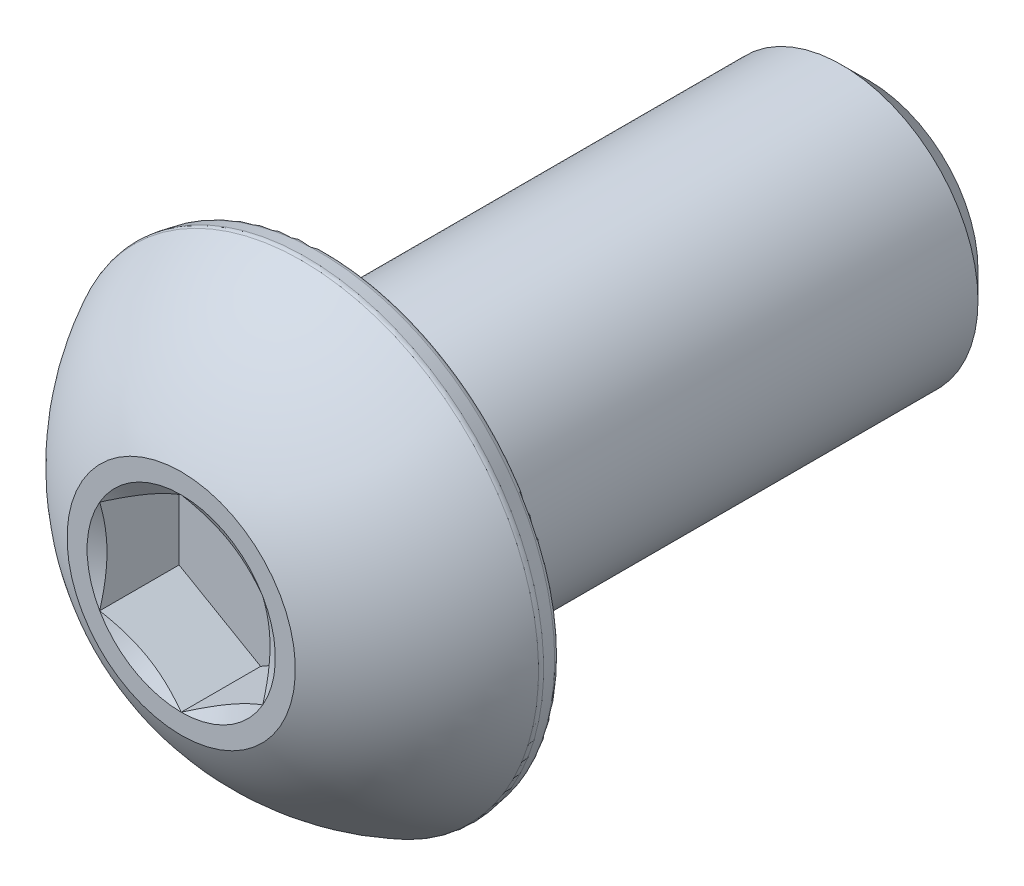
from build123d import *

# Parameters (mm, degrees)
CUT_EXTRUDE1_DEPTH = 2.31902
FILLET1_R          = 0.21082


with BuildPart() as part:
    # Sketch3 → Revolve1 (revolve)
    with BuildSketch(Plane(origin=(0, 0, 0), x_dir=(0, 0, -1), z_dir=(1, 0, 0)), mode=Mode.PRIVATE) as revolve1_sk:
        with BuildLine():
            Line((-10.0457, 0), (-10.0457, 3.33375))
            ThreePointArc((-10.0457, 3.33375), (-8.559598684, 5.443720932), (-6.46176, 6.9469))
            Line((-6.46176, 6.9469), (-5.8293, 6.835380238))
            Line((-5.8293, 6.835380238), (-5.8293, 3.9751))
            Line((-5.8293, 3.9751), (9.25195, 3.9751))
            Line((9.25195, 3.9751), (10.0457, 3.18135))
            Line((10.0457, 3.18135), (10.0457, 0))
            Line((10.0457, 0), (-10.0457, 0))
        make_face()
    revolve(revolve1_sk.sketch.rotate(Axis((0, 0, 10.0457), (0, 0, -1)), 90), axis=Axis((0, 0, 10.0457), (0, 0, -1)))

    # Sketch4 → Cut-Extrude1 (cut)
    with BuildSketch(Plane.XY.offset(10.0457)):
        Polygon((-2.38125, -1.374815329), (0, -2.749630657), (2.38125, -1.374815329), (2.38125, 1.374815329), (0, 2.749630657), (-2.38125, 1.374815329), align=None)
    extrude(amount=-CUT_EXTRUDE1_DEPTH, mode=Mode.SUBTRACT)

    # Cut-Extrude2 cone 1 section (through the dimple's axis) → Cut-Extrude2 (revolve, cut)
    with BuildSketch(Plane(origin=(0, 0, 10.0457), x_dir=(0, -1, 0), z_dir=(1, 0, 0))):
        Polygon((0, 0), (2.749630657, 0), (0, 1.5875), align=None)
    revolve(axis=Axis((0, 0, 10.0457), (0, 0, -1)), mode=Mode.SUBTRACT)

    # Fillet1
    fillet1_edges = [part.edges().sort_by_distance(p)[0] for p in [
        (-6.835380238, 0, 5.8293),
        (-6.9469, 0, 6.46176),
    ]]
    fillet(fillet1_edges, radius=FILLET1_R)


solid = part.part
